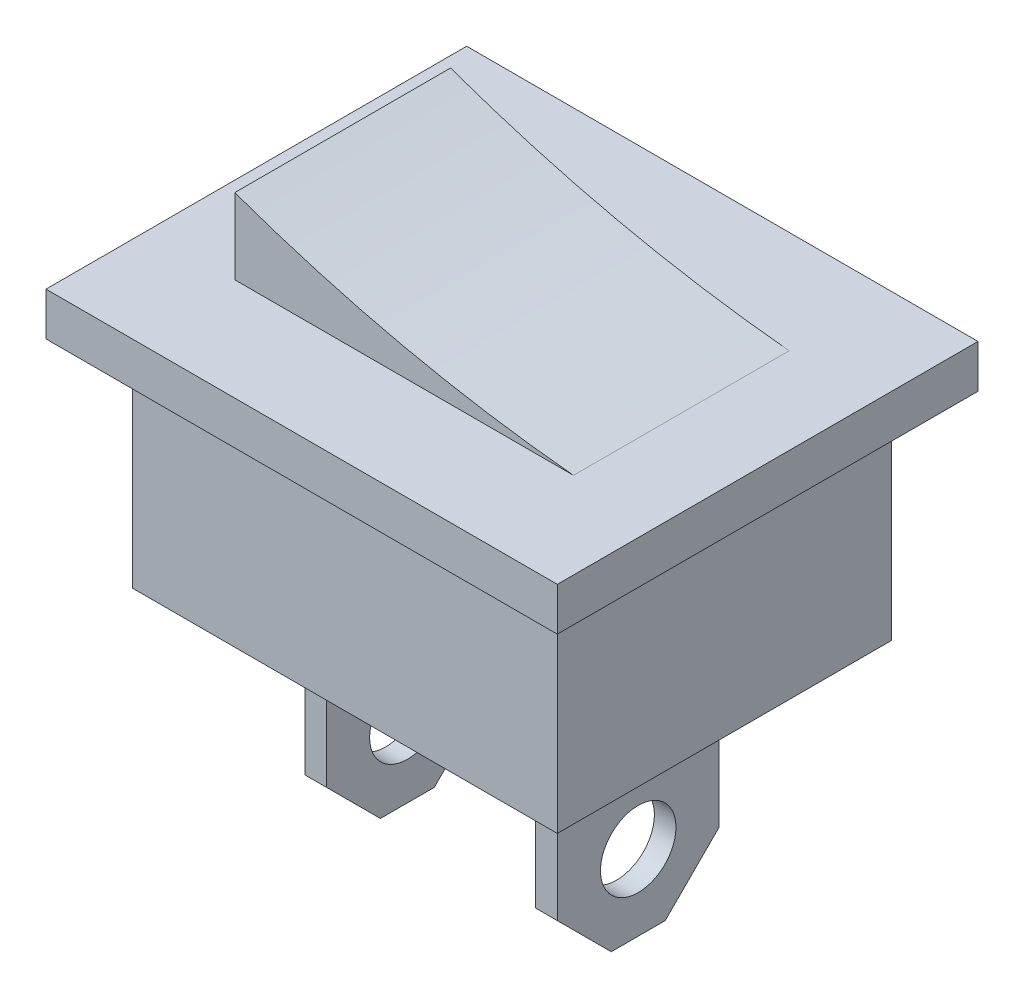
from build123d import *

# Parameters (mm, degrees)
CROQUIS1_W              = 19.7
CROQUIS1_H              = 15.5
SALIENTE_EXTRUIR1_DEPTH = 10
CROQUIS2_W              = 23.7
CROQUIS2_H              = 19.5
SALIENTE_EXTRUIR2_DEPTH = 2
SALIENTE_EXTRUIR3_DEPTH = 5
CROQUIS4_W              = 1
CROQUIS4_H              = 7.5
SALIENTE_EXTRUIR4_DEPTH = 10
CHAFL_N1_SIZE           = 2.5
CORTAR_EXTRUIR1_REACH   = 31.322
CROQUIS5_R              = 1.75


with BuildPart() as part:
    # Croquis1 → Saliente-Extruir1 (new body)
    with BuildSketch(Plane(origin=(0, 0, 0), x_dir=(1, 0, 0), z_dir=(0, 1, 0))):
        with Locations((9.85, 7.75)):
            Rectangle(CROQUIS1_W, CROQUIS1_H)
    extrude(amount=SALIENTE_EXTRUIR1_DEPTH)

    # Croquis2 → Saliente-Extruir2 (add)
    with BuildSketch(Plane(origin=(0, 10, 0), x_dir=(1, 0, 0), z_dir=(0, 1, 0))):
        with Locations((9.85, 7.75)):
            Rectangle(CROQUIS2_W, CROQUIS2_H)
    extrude(amount=SALIENTE_EXTRUIR2_DEPTH)

    # Croquis4 → Saliente-Extruir4 (add)
    with BuildSketch(Plane.XZ):
        with Locations((15.2, -7.75)):
            Rectangle(CROQUIS4_W, CROQUIS4_H)
        with Locations((4.5, -7.75)):
            Rectangle(CROQUIS4_W, CROQUIS4_H)
    extrude(amount=SALIENTE_EXTRUIR4_DEPTH)

    # Chaflán1
    chafl_n1_edges = [part.edges().sort_by_distance(p)[0] for p in [
        (15.2, -10, -11.5),
        (15.2, -10, -4),
        (4.5, -10, -11.5),
        (4.5, -10, -4),
    ]]
    chamfer(chafl_n1_edges, length=CHAFL_N1_SIZE)

    # Cortar-Extruir1: up to this face of the body (flat: up to its plane)
    cortar_extruir1_end = Plane(part.part.faces().sort_by_distance((4, -4.621212121, -7.75))[0])
    # Croquis5 → Cortar-Extruir1 (cut, up to the picked face)
    with BuildSketch(Plane(origin=(15.7, 0, 0), x_dir=(0, 0, -1), z_dir=(1, 0, 0)), mode=Mode.PRIVATE) as cortar_extruir1_sk1:
        with Locations((7.75, -6.5)):
            Circle(CROQUIS5_R)
    cortar_extruir1_tool1 = split(extrude(cortar_extruir1_sk1.sketch, amount=-CORTAR_EXTRUIR1_REACH, mode=Mode.PRIVATE), bisect_by=cortar_extruir1_end, keep=Keep.BOTH, mode=Mode.PRIVATE)
    add(cortar_extruir1_tool1.solids().sort_by(Axis((15.7, -6.5, -7.75), (-1, 0, 0)))[0], mode=Mode.SUBTRACT)


with BuildPart() as body_2:
    # Croquis3 → Saliente-Extruir3 (new, symmetric)
    with BuildSketch(Plane.XY.offset(-7.75)):
        with BuildLine():
            Line((2, 12), (2, 15.5))
            ThreePointArc((2, 15.5), (9.741315307, 13.262471521), (17.7, 12))
            Line((17.7, 12), (2, 12))
        make_face()
    extrude(amount=SALIENTE_EXTRUIR3_DEPTH, both=True)


solid = Compound([part.part, body_2.part])
